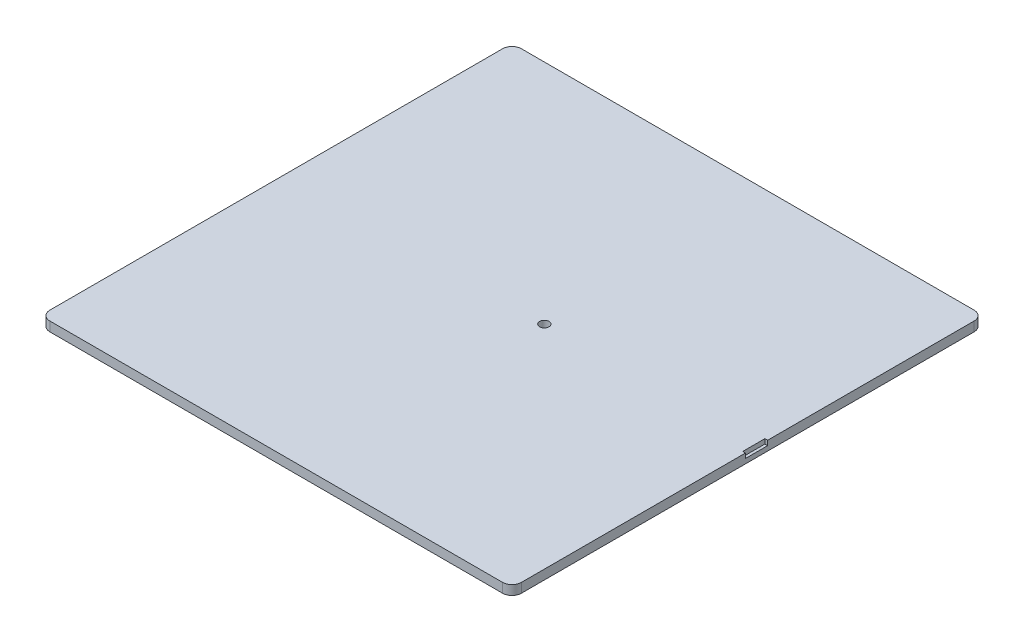
from build123d import *

# Parameters (mm, degrees)
SKETCH1_R           = 5
BOSS_EXTRUDE1_DEPTH = 5
SKETCH4_W           = 23.5
SKETCH4_H           = 4.988992324
CUT_EXTRUDE3_DEPTH  = 2.9


with BuildPart() as part:
    # Sketch1 → Boss-Extrude1 (new, symmetric)
    with BuildSketch(Plane(origin=(0, 0, 0), x_dir=(1, 0, 0), z_dir=(0, 1, 0))):
        with BuildLine():
            Line((-240, -250), (240, -250))
            ThreePointArc((240, -250), (247.071067812, -247.071067812), (250, -240))
            Line((250, -240), (250, 240))
            ThreePointArc((250, 240), (247.071067812, 247.071067812), (240, 250))
            Line((240, 250), (-240, 250))
            ThreePointArc((-240, 250), (-247.071067812, 247.071067812), (-250, 240))
            Line((-250, 240), (-250, -240))
            ThreePointArc((-250, -240), (-247.071067812, -247.071067812), (-240, -250))
        make_face()
        with Locations(Location((25.033256696, 9.291877303, 0), (0, 0, 270))):
            Circle(SKETCH1_R, mode=Mode.SUBTRACT)
    extrude(amount=BOSS_EXTRUDE1_DEPTH, both=True)

    # Sketch4 → Cut-Extrude3 (cut)
    with BuildSketch(Plane(origin=(250, 0, 0), x_dir=(0, 0, -1), z_dir=(1, 0, 0))):
        with Locations((9.291877303, 2.505503838)):
            Rectangle(SKETCH4_W, SKETCH4_H)
    extrude(amount=-CUT_EXTRUDE3_DEPTH, mode=Mode.SUBTRACT)


solid = part.part
